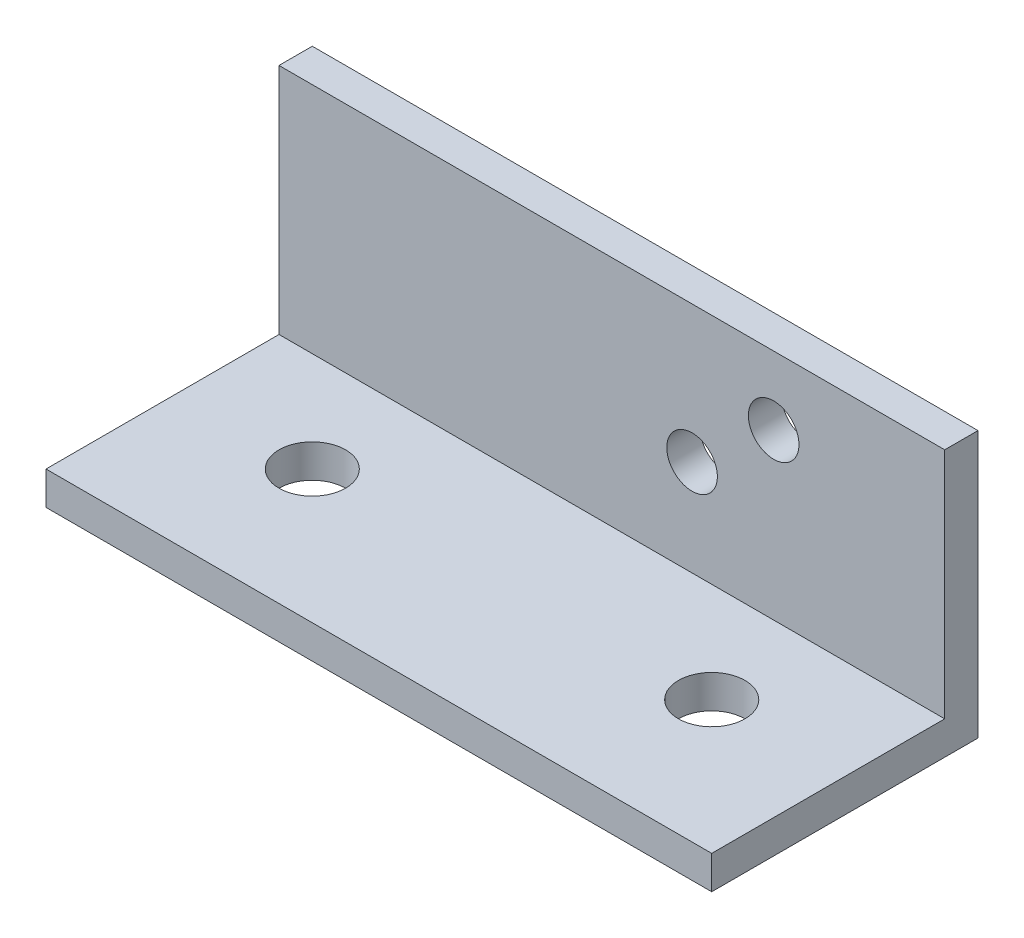
from build123d import *

# Parameters (mm, degrees)
SKETCH1_W           = 63.5
SKETCH1_H           = 25.4
BOSS_EXTRUDE1_DEPTH = 3.175
SKETCH2_W           = 63.5
SKETCH2_H           = 3.175
BOSS_EXTRUDE2_DEPTH = 22.225
SKETCH3_R           = 3.175
CUT_EXTRUDE1_DEPTH  = 3.175
SKETCH4_R           = 2.413
CUT_EXTRUDE2_DEPTH  = 3.175


with BuildPart() as part:
    # Sketch1 → Boss-Extrude1 (new body)
    with BuildSketch(Plane(origin=(0, 0, 0), x_dir=(1, 0, 0), z_dir=(0, 1, 0))):
        with Locations((31.75, -12.7)):
            Rectangle(SKETCH1_W, SKETCH1_H)
    extrude(amount=BOSS_EXTRUDE1_DEPTH)

    # Sketch2 → Boss-Extrude2 (add)
    with BuildSketch(Plane(origin=(0, 3.175, 0), x_dir=(1, 0, 0), z_dir=(0, 1, 0))):
        with Locations((31.75, -1.5875)):
            Rectangle(SKETCH2_W, SKETCH2_H)
    extrude(amount=BOSS_EXTRUDE2_DEPTH)

    # Sketch3 → Cut-Extrude1 (cut)
    with BuildSketch(Plane(origin=(0, 3.175, 0), x_dir=(1, 0, 0), z_dir=(0, 1, 0))):
        with BuildLine():
            ThreePointArc((50.8, -15.875), (53.04506403, -14.94506403), (53.975, -12.7))
            Line((53.975, -12.7), (50.8, -12.7))
            Line((50.8, -12.7), (50.8, -15.875))
        make_face()
        with BuildLine():
            Line((50.8, -12.7), (53.975, -12.7))
            ThreePointArc((53.975, -12.7), (48.55493597, -10.45493597), (50.8, -15.875))
            Line((50.8, -15.875), (50.8, -12.7))
        make_face()
        with Locations(Location((12.7, -12.7, 0), (0, 0, 270))):
            Circle(SKETCH3_R)
    extrude(amount=-CUT_EXTRUDE1_DEPTH, mode=Mode.SUBTRACT)

    # Sketch4 → Cut-Extrude2 (cut)
    with BuildSketch(Plane(origin=(0, 0, 0), x_dir=(-1, 0, 0), z_dir=(0, 0, -1))):
        with Locations((-47.184645461, 18.869277886)):
            Circle(SKETCH4_R)
        with Locations((-39.401633919, 12.338555771)):
            Circle(SKETCH4_R)
    extrude(amount=-CUT_EXTRUDE2_DEPTH, mode=Mode.SUBTRACT)


solid = part.part
